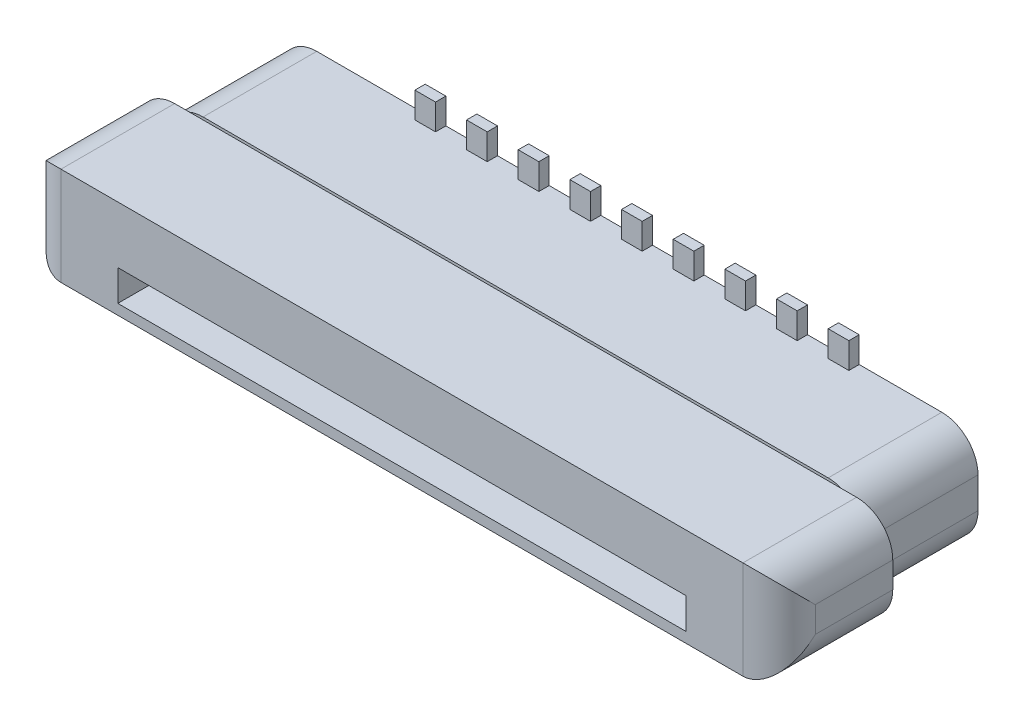
from build123d import *

# Parameters (mm, degrees)
SKETCH1_W           = 13.5
SKETCH1_H           = 2
BOSS_EXTRUDE1_DEPTH = 2.2
FILLET1_R           = 0.7
SKETCH2_W           = 14.6
SKETCH2_H           = 1.9
BOSS_EXTRUDE2_DEPTH = 2.2
FILLET2_R           = 0.7
SKETCH3_W           = 11
SKETCH3_H           = 0.6
CUT_EXTRUDE1_DEPTH  = 4
SKETCH4_W           = 0.4
SKETCH4_H           = 2.5
BOSS_EXTRUDE3_DEPTH = 0.2


with BuildPart() as part:
    # Sketch1 → Boss-Extrude1 (new body)
    with BuildSketch(Plane.XY):
        Rectangle(SKETCH1_W, SKETCH1_H)
    extrude(amount=BOSS_EXTRUDE1_DEPTH)

    # Fillet1
    fillet1_edges = [part.edges().sort_by_distance(p)[0] for p in [
        (6.75, -1, 1.1),
        (-6.75, -1, 1.1),
        (-6.75, 1, 1.1),
        (6.75, 1, 1.1),
    ]]
    fillet(fillet1_edges, radius=FILLET1_R)

    # Sketch2 → Boss-Extrude2 (add)
    with BuildSketch(Plane.XY.offset(2.2)):
        Rectangle(SKETCH2_W, SKETCH2_H)
    extrude(amount=BOSS_EXTRUDE2_DEPTH)

    # Fillet2
    fillet2_edges = [part.edges().sort_by_distance(p)[0] for p in [
        (7.3, 0.95, 3.3),
        (7.3, 0, 4.4),
        (7.3, -0.95, 3.3),
        (-7.3, -0.95, 3.3),
        (-7.3, 0, 4.4),
        (-7.3, 0.95, 3.3),
    ]]
    fillet(fillet2_edges, radius=FILLET2_R)

    # Sketch3 → Cut-Extrude1 (cut)
    with BuildSketch(Plane.XY.offset(4.4)):
        with Locations((0, -0.45)):
            Rectangle(SKETCH3_W, SKETCH3_H)
    extrude(amount=-CUT_EXTRUDE1_DEPTH, mode=Mode.SUBTRACT)

    # Sketch4 → Boss-Extrude3 (add)
    with BuildSketch(Plane(origin=(0, 0, 0), x_dir=(-1, 0, 0), z_dir=(0, 0, -1))):
        with Locations((4.25, -0.25)):
            Rectangle(SKETCH4_W, SKETCH4_H)
        with Locations((3.25, -0.25)):
            Rectangle(SKETCH4_W, SKETCH4_H)
        with Locations((2.25, -0.25)):
            Rectangle(SKETCH4_W, SKETCH4_H)
        with Locations((1.25, -0.25)):
            Rectangle(SKETCH4_W, SKETCH4_H)
        with Locations((0.25, -0.25)):
            Rectangle(SKETCH4_W, SKETCH4_H)
        with Locations((-0.75, -0.25)):
            Rectangle(SKETCH4_W, SKETCH4_H)
        with Locations((-1.75, -0.25)):
            Rectangle(SKETCH4_W, SKETCH4_H)
        with Locations((-2.75, -0.25)):
            Rectangle(SKETCH4_W, SKETCH4_H)
        with Locations((-3.75, -0.25)):
            Rectangle(SKETCH4_W, SKETCH4_H)
        with Locations((3.75, 0.25)):
            Rectangle(SKETCH4_W, SKETCH4_H)
        with Locations((2.75, 0.25)):
            Rectangle(SKETCH4_W, SKETCH4_H)
        with Locations((1.75, 0.25)):
            Rectangle(SKETCH4_W, SKETCH4_H)
        with Locations((0.75, 0.25)):
            Rectangle(SKETCH4_W, SKETCH4_H)
        with Locations((-0.25, 0.25)):
            Rectangle(SKETCH4_W, SKETCH4_H)
        with Locations((-1.25, 0.25)):
            Rectangle(SKETCH4_W, SKETCH4_H)
        with Locations((-2.25, 0.25)):
            Rectangle(SKETCH4_W, SKETCH4_H)
        with Locations((-3.25, 0.25)):
            Rectangle(SKETCH4_W, SKETCH4_H)
        with Locations((-4.25, 0.25)):
            Rectangle(SKETCH4_W, SKETCH4_H)
    extrude(amount=-BOSS_EXTRUDE3_DEPTH)


solid = part.part
